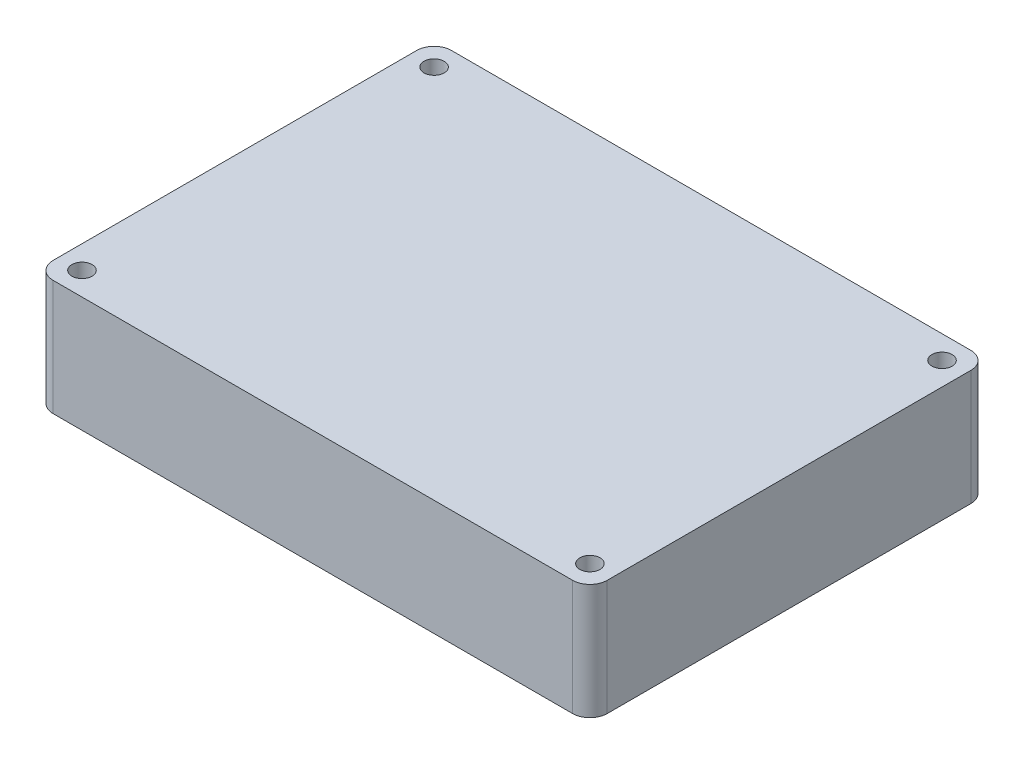
from build123d import *

# Parameters (mm, degrees)
SKETCH_1_W      = 96
SKETCH_1_H      = 69
SKETCH_1_R      = 1.75
EXTRUDE_1_DEPTH = 20
FILLET_1_R      = 3


with BuildPart() as part:
    # 草图1 → 凸台-拉伸1 (new body)
    with BuildSketch(Plane(origin=(0, 0, 0), x_dir=(1, 0, 0), z_dir=(0, 1, 0))):
        Rectangle(SKETCH_1_W, SKETCH_1_H)
        with Locations(Location((-44, 30.5, 0), (0, 0, 270))):
            Circle(SKETCH_1_R, mode=Mode.SUBTRACT)
        with Locations(Location((44, 30.5, 0), (0, 0, 270))):
            Circle(SKETCH_1_R, mode=Mode.SUBTRACT)
        with Locations(Location((-44, -30.5, 0), (0, 0, 270))):
            Circle(SKETCH_1_R, mode=Mode.SUBTRACT)
        with Locations(Location((44, -30.5, 0), (0, 0, 270))):
            Circle(SKETCH_1_R, mode=Mode.SUBTRACT)
    extrude(amount=EXTRUDE_1_DEPTH)

    # 圆角1
    fillet_1_edges = [part.edges().sort_by_distance(p)[0] for p in [
        (48, 10, 34.5),
        (-48, 10, 34.5),
        (-48, 10, -34.5),
        (48, 10, -34.5),
    ]]
    fillet(fillet_1_edges, radius=FILLET_1_R)


solid = part.part
